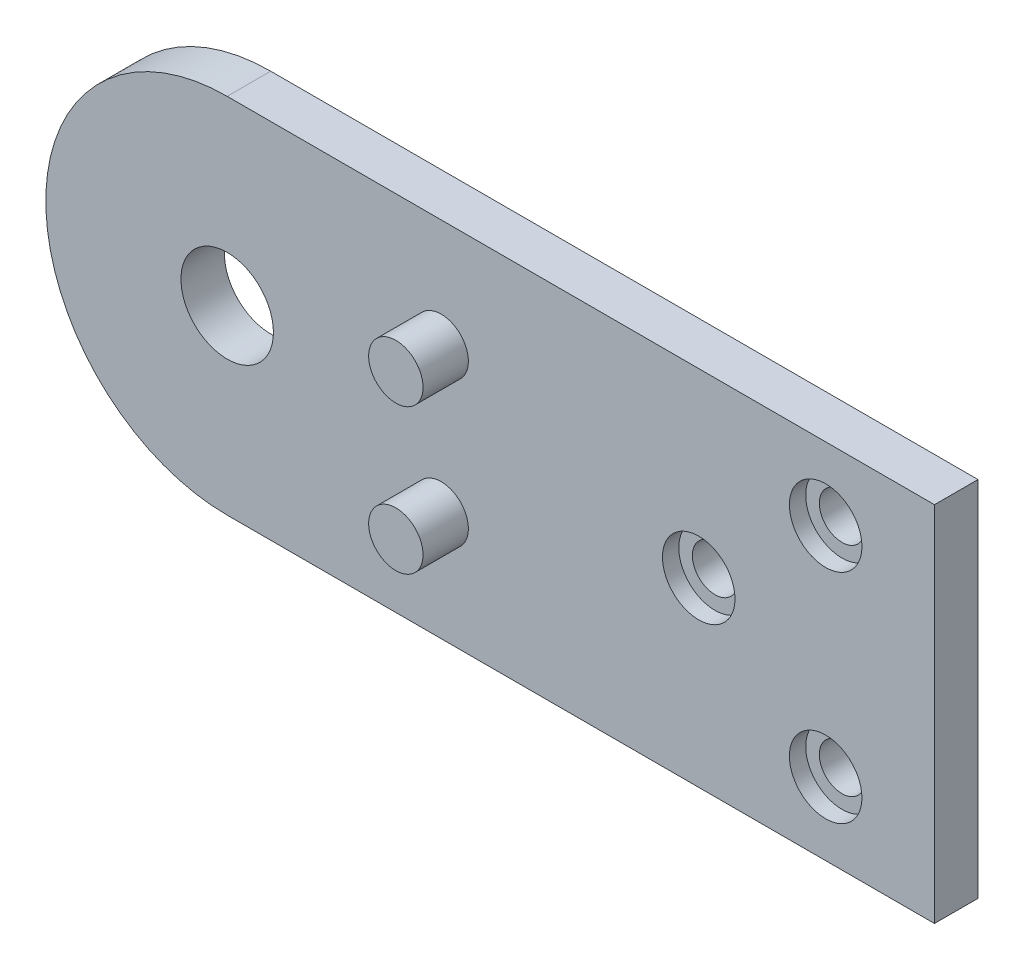
from build123d import *

# Parameters (mm, degrees)
EXTRUDE_1_DEPTH     = 2.4
SKETCH_2_R          = 1.25
CUT_EXTRUDE_1_DEPTH = 41.333112947
CUT_EXTRUDE_START   = -1.5
SKETCH_2_3_R        = 2
SKETCH_2_3_R_2      = 1.25
CUT_EXTRUDE_2_DEPTH = 0.9
SKETCH_3_R          = 2.55
CUT_EXTRUDE_3_DEPTH = 41.333112947
SKETCH_4_R          = 1.5
EXTRUDE_2_DEPTH     = 2.5


with BuildPart() as part:
    # 草图1 → 凸台-拉伸1 (new body)
    with BuildSketch(Plane.XY):
        with BuildLine():
            Line((0, -10), (39, -10))
            Line((39, -10), (39, 10))
            Line((39, 10), (0, 10))
            ThreePointArc((0, 10), (-10, 0), (0, -10))
        make_face()
    extrude(amount=EXTRUDE_1_DEPTH)

    # 草图2 → 切除-拉伸1 (cut, through all)
    with BuildSketch(Plane(origin=(0, 0, 0), x_dir=(-1, 0, 0), z_dir=(0, 0, -1))):
        with Locations((-33, 6)):
            Circle(SKETCH_2_R)
        with Locations((-33, -6)):
            Circle(SKETCH_2_R)
        with Locations((-26, 0)):
            Circle(SKETCH_2_R)
    extrude(amount=-CUT_EXTRUDE_1_DEPTH, mode=Mode.SUBTRACT)

    # 草图2<3> → 切除-拉伸2 (cut)
    # profile 1 of 3: a face of its own
    with BuildSketch(Plane(origin=(0, 0, 0), x_dir=(-1, 0, 0), z_dir=(0, 0, -1)).offset(CUT_EXTRUDE_START)):
        with Locations(Location((-33, 6, 0), (0, 0, 180))):
            Circle(SKETCH_2_3_R)
        with Locations((-33, 6)):
            Circle(SKETCH_2_3_R_2, mode=Mode.SUBTRACT)
    # profile 2 of 3: a face of its own
    with BuildSketch(Plane(origin=(0, 0, 0), x_dir=(-1, 0, 0), z_dir=(0, 0, -1)).offset(CUT_EXTRUDE_START)):
        with Locations(Location((-33, -6, 0), (0, 0, 180))):
            Circle(SKETCH_2_3_R)
        with Locations((-33, -6)):
            Circle(SKETCH_2_3_R_2, mode=Mode.SUBTRACT)
    # profile 3 of 3: a face of its own
    with BuildSketch(Plane(origin=(0, 0, 0), x_dir=(-1, 0, 0), z_dir=(0, 0, -1)).offset(CUT_EXTRUDE_START)):
        with Locations(Location((-26, 0, 0), (0, 0, 180))):
            Circle(SKETCH_2_3_R)
        with Locations((-26, 0)):
            Circle(SKETCH_2_3_R_2, mode=Mode.SUBTRACT)
    extrude(amount=-CUT_EXTRUDE_2_DEPTH, mode=Mode.SUBTRACT)

    # 草图3 → 切除-拉伸3 (cut, through all)
    with BuildSketch(Plane.XY.offset(2.4)):
        Circle(SKETCH_3_R)
    extrude(amount=-CUT_EXTRUDE_3_DEPTH, mode=Mode.SUBTRACT)

    # 草图4 → 凸台-拉伸2 (add)
    with BuildSketch(Plane.XY.offset(2.4)):
        with Locations((11.8, -4)):
            Circle(SKETCH_4_R)
        with Locations((11.8, 4)):
            Circle(SKETCH_4_R)
    extrude(amount=EXTRUDE_2_DEPTH)


solid = part.part
